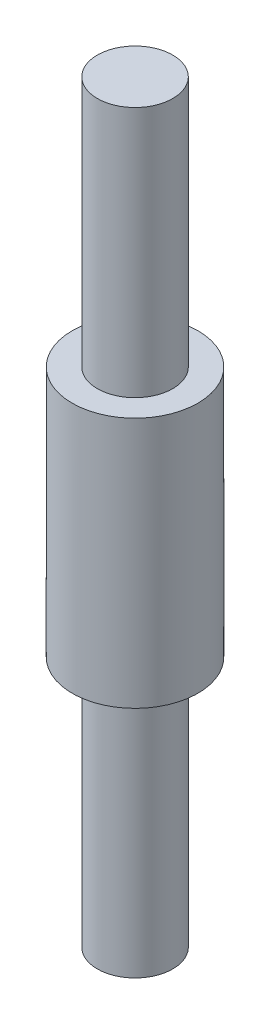
from build123d import *

# Parameters (mm, degrees)
SKETCH1_R           = 2.5
BOSS_EXTRUDE1_DEPTH = 15
SKETCH2_R           = 12.5
SKETCH2_R_2         = 1.5
CUT_EXTRUDE1_DEPTH  = 10


with BuildPart() as part:
    # Sketch1 → Boss-Extrude1 (new, symmetric)
    with BuildSketch(Plane(origin=(0, 0, 0), x_dir=(1, 0, 0), z_dir=(0, 1, 0))):
        with Locations(Location((0, 0, 0), (0, 0, 270))):
            Circle(SKETCH1_R)
    extrude(amount=BOSS_EXTRUDE1_DEPTH, both=True)

    # Sketch2 → Cut-Extrude1 (cut)
    with BuildSketch(Plane(origin=(0, 15, 0), x_dir=(1, 0, 0), z_dir=(0, 1, 0))):
        Circle(SKETCH2_R)
        with Locations(Location((0, 0, 0), (0, 0, 270))):
            Circle(SKETCH2_R_2, mode=Mode.SUBTRACT)
    cut_extrude1 = extrude(amount=-CUT_EXTRUDE1_DEPTH, mode=Mode.SUBTRACT)

    # Mirror1: Cut-Extrude1 across plane
    add(cut_extrude1.mirror(Plane.ZX), mode=Mode.SUBTRACT)


solid = part.part
